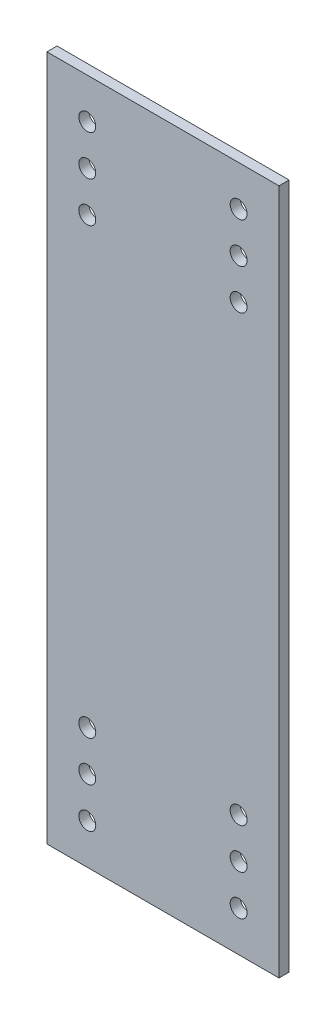
from build123d import *

# Parameters (mm, degrees)
SKETCH1_W           = 73.025
SKETCH1_H           = 215.9
BOSS_EXTRUDE1_DEPTH = 3.175
SKETCH2_R           = 2.667
CUT_EXTRUDE1_DEPTH  = 3.175


with BuildPart() as part:
    # Sketch1 → Boss-Extrude1 (new body)
    with BuildSketch(Plane.XY):
        Rectangle(SKETCH1_W, SKETCH1_H)
    extrude(amount=BOSS_EXTRUDE1_DEPTH)

    # Sketch2 → Cut-Extrude1 (cut)
    with BuildSketch(Plane.XY.offset(3.175)):
        with Locations((-23.8125, -69.85)):
            Circle(SKETCH2_R)
        with Locations((-23.8125, -82.55)):
            Circle(SKETCH2_R)
        with Locations((-23.8125, -95.25)):
            Circle(SKETCH2_R)
        with Locations(Location((-23.8125, 95.25, 0), (0, 0, 180))):
            Circle(SKETCH2_R)
        with Locations(Location((-23.8125, 82.55, 0), (0, 0, 180))):
            Circle(SKETCH2_R)
        with Locations(Location((-23.8125, 69.85, 0), (0, 0, 180))):
            Circle(SKETCH2_R)
        with Locations((23.8125, 95.25)):
            Circle(SKETCH2_R)
        with Locations((23.8125, 82.55)):
            Circle(SKETCH2_R)
        with Locations((23.8125, 69.85)):
            Circle(SKETCH2_R)
        with Locations(Location((23.8125, -95.25, 0), (0, 0, 180))):
            Circle(SKETCH2_R)
        with Locations(Location((23.8125, -82.55, 0), (0, 0, 180))):
            Circle(SKETCH2_R)
        with Locations(Location((23.8125, -69.85, 0), (0, 0, 180))):
            Circle(SKETCH2_R)
    extrude(amount=-CUT_EXTRUDE1_DEPTH, mode=Mode.SUBTRACT)


solid = part.part
